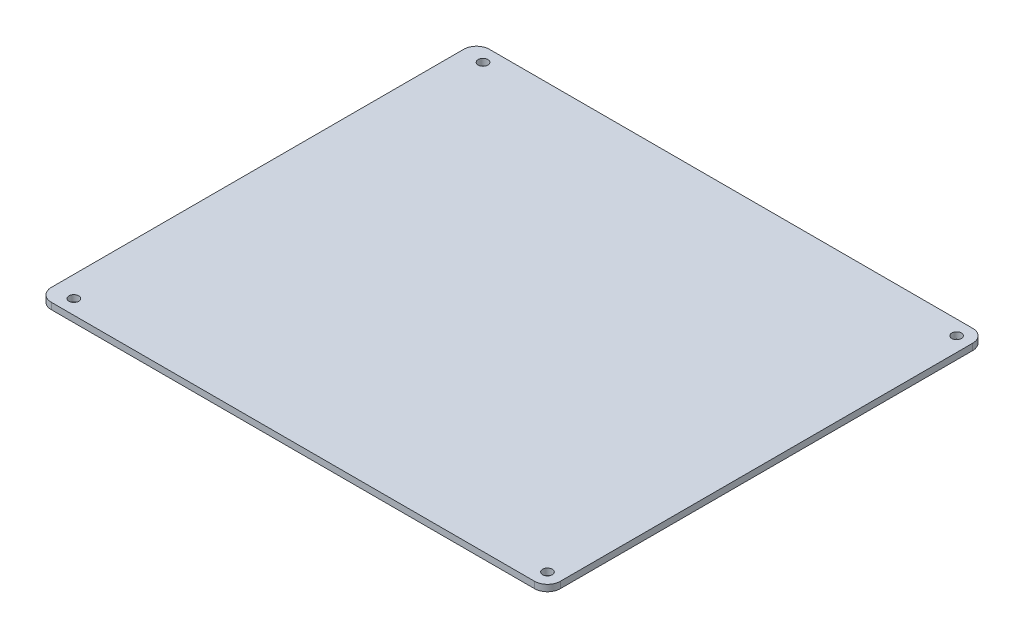
from build123d import *

# Parameters (mm, degrees)
SKETCH8_W           = 158
SKETCH8_H           = 136
SKETCH8_R           = 1.5
BOSS_EXTRUDE4_DEPTH = 2
FILLET2_R           = 4
CUT_EXTRUDE1_DEPTH  = 0.5
CUT_EXTRUDE2_DEPTH  = 0.5
SKETCH13_W          = 6.35
SKETCH13_H          = 1.383974359
CUT_EXTRUDE3_DEPTH  = 0.5
SKETCH14_R          = 0.750267771
SKETCH14_R_2        = 0.265378854
SKETCH14_R_3        = 0.744648083
SKETCH14_R_4        = 0.32969998
SKETCH14_R_5        = 0.283853506
SKETCH14_R_6        = 0.632780779
SKETCH14_W          = 2.64350155
SKETCH14_H          = 3.390658062
CUT_EXTRUDE5_DEPTH  = 0.5
SKETCH15_R          = 1.209251999
CUT_EXTRUDE6_DEPTH  = 0.5


with BuildPart() as part:
    # Sketch8 → Boss-Extrude4 (new body)
    with BuildSketch(Plane(origin=(0, 0, 0), x_dir=(1, 0, 0), z_dir=(0, 1, 0))):
        Rectangle(SKETCH8_W, SKETCH8_H)
        with Locations(Location((74.5, 63.5, 0), (0, 0, 270))):
            Circle(SKETCH8_R, mode=Mode.SUBTRACT)
        with Locations(Location((-72.5, 63.5, 0), (0, 0, 270))):
            Circle(SKETCH8_R, mode=Mode.SUBTRACT)
        with Locations(Location((-72.5, -63.5, 0), (0, 0, 90))):
            Circle(SKETCH8_R, mode=Mode.SUBTRACT)
        with Locations(Location((74.5, -63.5, 0), (0, 0, 90))):
            Circle(SKETCH8_R, mode=Mode.SUBTRACT)
    extrude(amount=BOSS_EXTRUDE4_DEPTH)

    # Fillet2
    fillet2_edges = [part.edges().sort_by_distance(p)[0] for p in [
        (79, 1, 68),
        (-79, 1, 68),
        (-79, 1, -68),
        (79, 1, -68),
    ]]
    fillet(fillet2_edges, radius=FILLET2_R)

    # Sketch10 → Cut-Extrude1 (cut)
    with BuildSketch(Plane.XZ):
        with BuildLine():
            Line((-63.5, 55), (63.5, 55))
            ThreePointArc((63.5, 55), (66.328427125, 53.828427125), (67.5, 51))
            Line((67.5, 51), (67.5, -51))
            ThreePointArc((67.5, -51), (66.328427125, -53.828427125), (63.5, -55))
            Line((63.5, -55), (-63.5, -55))
            ThreePointArc((-63.5, -55), (-66.328427125, -53.828427125), (-67.5, -51))
            Line((-67.5, -51), (-67.5, 51))
            ThreePointArc((-67.5, 51), (-66.328427125, 53.828427125), (-63.5, 55))
        make_face()
        with BuildLine():
            Line((-65.5, 51), (-65.5, -51))
            ThreePointArc((-65.5, -51), (-64.914213562, -52.414213562), (-63.5, -53))
            Line((-63.5, -53), (63.5, -53))
            ThreePointArc((63.5, -53), (64.914213562, -52.414213562), (65.5, -51))
            Line((65.5, -51), (65.5, 51))
            ThreePointArc((65.5, 51), (64.914213562, 52.414213562), (63.5, 53))
            Line((63.5, 53), (-63.5, 53))
            ThreePointArc((-63.5, 53), (-64.914213562, 52.414213562), (-65.5, 51))
        make_face(mode=Mode.SUBTRACT)
    extrude(amount=-CUT_EXTRUDE1_DEPTH, mode=Mode.SUBTRACT)

    # Sketch11 → Cut-Extrude2 (cut)
    with BuildSketch(Plane.XZ):
        with BuildLine():
            Line((-55.5, 48), (-8.613772343, 48))
            ThreePointArc((-8.613772343, 48), (-5.785345218, 46.828427125), (-4.613772343, 44))
            Line((-4.613772343, 44), (-4.613772343, -44))
            ThreePointArc((-4.613772343, -44), (-5.785345218, -46.828427125), (-8.613772343, -48))
            Line((-8.613772343, -48), (-55.5, -48))
            ThreePointArc((-55.5, -48), (-58.328427125, -46.828427125), (-59.5, -44))
            Line((-59.5, -44), (-59.5, 44))
            ThreePointArc((-59.5, 44), (-58.328427125, 46.828427125), (-55.5, 48))
        make_face()
        with BuildLine():
            Line((-57.6, 44), (-57.6, -44))
            ThreePointArc((-57.6, -44), (-56.98492424, -45.48492424), (-55.5, -46.1))
            Line((-55.5, -46.1), (-8.613772343, -46.1))
            ThreePointArc((-8.613772343, -46.1), (-7.128848102, -45.48492424), (-6.513772343, -44))
            Line((-6.513772343, -44), (-6.513772343, 44))
            ThreePointArc((-6.513772343, 44), (-7.128848102, 45.48492424), (-8.613772343, 46.1))
            Line((-8.613772343, 46.1), (-55.5, 46.1))
            ThreePointArc((-55.5, 46.1), (-56.98492424, 45.48492424), (-57.6, 44))
        make_face(mode=Mode.SUBTRACT)
    extrude(amount=-CUT_EXTRUDE2_DEPTH, mode=Mode.SUBTRACT)

    # Sketch13 → Cut-Extrude3 (cut)
    # profile 1 of 21: a face of its own
    with BuildSketch(Plane.XZ):
        Polygon((-40.863772343, 36.024038462), (-40.863772343, 37.367307692), (-36.685136525, 40.583012821), (-40.863772343, 40.583012821), (-40.863772343, 41.966987179), (-34.513772343, 41.966987179), (-34.513772343, 40.612269631), (-38.679687807, 37.408012821), (-34.513772343, 37.408012821), (-34.513772343, 36.024038462), align=None)
    # profile 2 of 21: a face of its own
    with BuildSketch(Plane.XZ):
        Polygon((-40.863772343, 30.550470753), (-40.863772343, 31.970062099), (-34.513772343, 34.843589744), (-34.513772343, 33.36421274), (-35.816336445, 32.786708734), (-35.816336445, 29.737640224), (-34.513772343, 29.160136218), (-34.513772343, 27.679487179), align=None)
        Polygon((-39.160517134, 31.261538462), (-36.956080035, 30.241366186), (-36.956080035, 32.281710737), align=None, mode=Mode.SUBTRACT)
    # profile 3 of 21: a face of its own
    with BuildSketch(Plane.XZ):
        Polygon((-40.863772343, 18.317307692), (-40.863772343, 19.740715144), (-36.809795981, 20.841025641), (-40.863772343, 22.195743189), (-40.863772343, 23.399088542), (-36.809795981, 24.748717949), (-40.863772343, 25.846484375), (-40.863772343, 27.272435897), (-34.513772343, 25.551372196), (-34.513772343, 24.162309696), (-38.618630115, 22.794871795), (-34.513772343, 21.423617788), (-34.513772343, 20.0421875), align=None)
    # profile 4 of 21: a face of its own
    with BuildSketch(Plane.XZ):
        Polygon((-40.863772343, 13.454316907), (-40.863772343, 14.873908253), (-34.513772343, 17.747435897), (-34.513772343, 16.268058894), (-35.816336445, 15.690554888), (-35.816336445, 12.641486378), (-34.513772343, 12.063982372), (-34.513772343, 10.583333333), align=None)
        Polygon((-39.160517134, 14.165384615), (-36.956080035, 13.14521234), (-36.956080035, 15.185556891), align=None, mode=Mode.SUBTRACT)
    # profile 5 of 21: a face of its own
    with BuildSketch(Plane.XZ):
        Polygon((-40.863772343, 2.372345753), (-40.863772343, 3.795753205), (-36.43454558, 5.535897436), (-40.863772343, 7.279857772), (-40.863772343, 8.694360978), (-34.513772343, 9.891346154), (-34.513772343, 8.489563301), (-38.524499506, 7.733974359), (-34.513772343, 6.152834535), (-34.513772343, 4.91260016), (-38.524499506, 3.337820513), (-34.513772343, 2.584775641), (-34.513772343, 1.180448718), align=None)
    # profile 6 of 21: a face of its own
    with BuildSketch(Plane.XZ):
        with BuildLine():
            Line((-40.863772343, -4.192628205), (-40.863772343, -2.671274038))
            add(Edge.make_bspline(
                [(-40.863772343, -2.671274038), (-40.863463949, -2.570773745), (-40.862870449, -2.377361972), (-40.853358626, -2.098320368), (-40.840390508, -1.841613838), (-40.819717429, -1.607508276), (-40.795368963, -1.395982248), (-40.763217723, -1.207217685), (-40.727737246, -1.040251416), (-40.683396282, -0.893415787), (-40.633173887, -0.761201146), (-40.575022733, -0.63833205), (-40.511217801, -0.520810892), (-40.436206645, -0.412235155), (-40.357716821, -0.307534982), (-40.269344794, -0.211169136), (-40.173802085, -0.12048629), (-40.070778161, -0.036928425), (-39.962419, 0.039886164), (-39.846944317, 0.104087542), (-39.728095649, 0.161192378), (-39.603745026, 0.206843807), (-39.47406269, 0.240820403), (-39.340685495, 0.266425943), (-39.202022267, 0.282170317), (-39.107981225, 0.284001905), (-39.060026349, 0.284935897)],
                knots=[0, 0, 0, 0, 1.836140719, 3.533633771, 5.10087734, 6.53173273, 7.827060477, 8.989882129, 10.029329562, 10.943526483, 11.789528399, 12.610909349, 13.425834763, 14.229450232, 15.019697848, 15.81494229, 16.615039843, 17.424496889, 18.236877441, 19.038286661, 19.835340363, 20.644166918, 21.454105773, 22.282181885, 23.124023373, 24, 24, 24, 24], degree=3))
            add(Edge.make_bspline(
                [(-39.060026349, 0.284935897), (-39.009945766, 0.284090021), (-38.911618045, 0.282429236), (-38.767344698, 0.265472128), (-38.628993775, 0.237558168), (-38.49711043, 0.198141717), (-38.371216227, 0.148528159), (-38.252182758, 0.086729315), (-38.139138514, 0.014602467), (-38.032664003, -0.069338377), (-37.931809995, -0.163063155), (-37.83890069, -0.270098031), (-37.750948816, -0.387168277), (-37.669231983, -0.515806687), (-37.596359904, -0.656638526), (-37.526776162, -0.807276811), (-37.464892326, -0.969802505), (-37.429524216, -1.083150851), (-37.411468657, -1.141015625)],
                knots=[0, 0, 0, 0, 1.016036467, 1.994875957, 2.943360592, 3.877249563, 4.784919431, 5.685545373, 6.595049126, 7.502270147, 8.433777149, 9.38499057, 10.374627171, 11.403591613, 12.473727256, 13.590459233, 14.769920025, 16, 16, 16, 16], degree=3))
            Line((-37.411468657, -1.141015625), (-34.513772343, 0.651282051))
            Line((-34.513772343, 0.651282051), (-34.513772343, -0.909505208))
            Line((-34.513772343, -0.909505208), (-37.281721061, -2.621664663))
            Line((-37.281721061, -2.621664663), (-37.281721061, -2.808653846))
            Line((-37.281721061, -2.808653846), (-34.513772343, -2.808653846))
            Line((-34.513772343, -2.808653846), (-34.513772343, -4.192628205))
            Line((-34.513772343, -4.192628205), (-40.863772343, -4.192628205))
        make_face()
        with BuildLine():
            Line((-38.42146465, -2.808653846), (-38.42146465, -2.343088942))
            add(Edge.make_bspline(
                [(-38.42146465, -2.343088942), (-38.422075091, -2.286269231), (-38.423246263, -2.177256851), (-38.428715242, -2.020181447), (-38.441690535, -1.877218578), (-38.458396256, -1.747855822), (-38.477087139, -1.632195612), (-38.504769125, -1.530986178), (-38.534135134, -1.442687552), (-38.570112058, -1.367480881), (-38.6118507, -1.303554766), (-38.658790284, -1.248145377), (-38.713317559, -1.202113783), (-38.772979972, -1.162908745), (-38.840875274, -1.135811461), (-38.9129925, -1.113652171), (-38.992152344, -1.100709267), (-39.046835051, -1.099610327), (-39.075290772, -1.099038462)],
                knots=[0, 0, 0, 0, 1.708363675, 3.277608857, 4.723712974, 6.021838054, 7.199660436, 8.241690857, 9.172961181, 9.993967569, 10.739999558, 11.46313589, 12.168296226, 12.87908003, 13.598837728, 14.357076655, 15.145057537, 16, 16, 16, 16], degree=3))
            add(Edge.make_bspline(
                [(-39.075290772, -1.099038462), (-39.108998893, -1.100141009), (-39.17491013, -1.102296878), (-39.269569741, -1.130163652), (-39.358991926, -1.170007436), (-39.438450687, -1.230007455), (-39.510565985, -1.301483002), (-39.571507926, -1.385948877), (-39.621194137, -1.481690295), (-39.654902612, -1.569824329), (-39.674580548, -1.651130443), (-39.688343804, -1.724120756), (-39.699785421, -1.809035056), (-39.707917495, -1.905017451), (-39.716032179, -2.01268098), (-39.720803061, -2.131891877), (-39.723024397, -2.262941872), (-39.723684769, -2.35411244), (-39.724028753, -2.401602564)],
                knots=[0, 0, 0, 0, 0.985108331, 1.926233394, 2.871946939, 3.841872085, 4.82658799, 5.841305238, 6.881378339, 7.9830261, 8.598222287, 9.332244696, 10.160477909, 11.109455359, 12.156565321, 13.326411148, 14.607345905, 16, 16, 16, 16], degree=3))
            Line((-39.724028753, -2.401602564), (-39.724028753, -2.808653846))
            Line((-39.724028753, -2.808653846), (-38.42146465, -2.808653846))
        make_face(mode=Mode.SUBTRACT)
    # profile 7 of 21: a face of its own
    with BuildSketch(Plane.XZ):
        Polygon((-40.863772343, -9.666195913), (-40.863772343, -8.246604567), (-34.513772343, -5.373076923), (-34.513772343, -6.852453926), (-35.816336445, -7.429957933), (-35.816336445, -10.479026442), (-34.513772343, -11.056530449), (-34.513772343, -12.537179487), align=None)
        Polygon((-39.160517134, -8.955128205), (-36.956080035, -9.975300481), (-36.956080035, -7.934955929), align=None, mode=Mode.SUBTRACT)
    # profile 8 of 21: a face of its own
    with BuildSketch(Plane.XZ):
        with BuildLine():
            Line((-40.863772343, -19.172115385), (-40.863772343, -17.481580529))
            add(Edge.make_bspline(
                [(-40.863772343, -17.481580529), (-40.86300819, -17.349690454), (-40.861530827, -17.09470274), (-40.84423222, -16.725240694), (-40.81894765, -16.381817233), (-40.780044465, -16.065013756), (-40.734821964, -15.773667065), (-40.674826999, -15.509181238), (-40.605736321, -15.270458541), (-40.52465858, -15.055098078), (-40.42984309, -14.858155873), (-40.324433929, -14.671421619), (-40.204227453, -14.494575285), (-40.071668097, -14.325815384), (-39.924899655, -14.166362816), (-39.76373226, -14.016508596), (-39.591144315, -13.873610423), (-39.405203535, -13.741708178), (-39.209575889, -13.620927755), (-39.003462061, -13.516368575), (-38.789717131, -13.427133472), (-38.567313285, -13.354214315), (-38.33659446, -13.298805092), (-38.098275975, -13.257922222), (-37.851698389, -13.233115273), (-37.684589792, -13.230496509), (-37.599729875, -13.229166667)],
                knots=[0, 0, 0, 0, 1.5523959, 3.001301528, 4.352999285, 5.604799306, 6.757683279, 7.822029648, 8.794919534, 9.681123577, 10.527248426, 11.365490068, 12.203018135, 13.041779708, 13.889551746, 14.75116885, 15.630529516, 16.525224616, 17.432610275, 18.334419173, 19.242820097, 20.156703043, 21.086422976, 22.033347148, 23.001308118, 24, 24, 24, 24], degree=3))
            add(Edge.make_bspline(
                [(-37.599729875, -13.229166667), (-37.539081149, -13.230361997), (-37.419350911, -13.23272177), (-37.241302175, -13.244954796), (-37.067449829, -13.268726737), (-36.896413459, -13.298279932), (-36.729666434, -13.339522859), (-36.566245621, -13.389349927), (-36.406329465, -13.447382434), (-36.200199714, -13.537381995), (-35.955668679, -13.667614005), (-35.684872281, -13.852836422), (-35.441251127, -14.067070688), (-35.226528541, -14.307020469), (-35.039880488, -14.56508809), (-34.882348185, -14.835402935), (-34.756796448, -15.116837412), (-34.677768368, -15.363904848), (-34.62833426, -15.578759511), (-34.599358576, -15.767683193), (-34.572851408, -15.982758944), (-34.549623598, -16.224893659), (-34.53397548, -16.494336183), (-34.523065669, -16.790796392), (-34.514974531, -17.114343028), (-34.514183977, -17.339107065), (-34.513772343, -17.456139824)],
                knots=[0, 0, 0, 0, 0.72867537, 1.438521159, 2.142347153, 2.835755973, 3.522642296, 4.204220005, 4.887451593, 5.564982256, 6.904909641, 8.208980868, 9.49747035, 10.792307207, 12.06895256, 13.317393139, 14.544146306, 15.763570442, 16.427113542, 17.190819835, 18.058265318, 19.030390145, 20.11227009, 21.299973169, 22.594118552, 24, 24, 24, 24], degree=3))
            Line((-34.513772343, -17.456139824), (-34.513772343, -19.172115385))
            Line((-34.513772343, -19.172115385), (-40.863772343, -19.172115385))
        make_face()
        with BuildLine():
            Line((-39.724028753, -17.788141026), (-35.653515932, -17.788141026))
            Line((-35.653515932, -17.788141026), (-35.653515932, -17.106330128))
            add(Edge.make_bspline(
                [(-35.653515932, -17.106330128), (-35.65387117, -17.025334708), (-35.654557703, -16.868802439), (-35.663531309, -16.642690879), (-35.678238594, -16.433888519), (-35.70017923, -16.2426029), (-35.725929949, -16.068343385), (-35.758977404, -15.911158795), (-35.797528978, -15.770972635), (-35.844289197, -15.646596577), (-35.897361026, -15.53337001), (-35.958785898, -15.427781175), (-36.028014301, -15.326563144), (-36.104666457, -15.230159854), (-36.191506123, -15.140885457), (-36.284169584, -15.054981044), (-36.386462781, -14.974904042), (-36.496408527, -14.900334115), (-36.613728831, -14.832222423), (-36.738328941, -14.774373392), (-36.869069215, -14.724063656), (-37.006553684, -14.683694794), (-37.150648274, -14.65201576), (-37.301423516, -14.628727051), (-37.458762019, -14.616702009), (-37.565791772, -14.614339437), (-37.620082439, -14.613141026)],
                knots=[0, 0, 0, 0, 1.593054988, 3.078748262, 4.45018865, 5.709219076, 6.86516435, 7.91367016, 8.866821376, 9.721920118, 10.52404956, 11.323703758, 12.121790688, 12.934559088, 13.742692869, 14.569082968, 15.418345626, 16.295053143, 17.180562888, 18.083458198, 18.994215758, 19.933658199, 20.898883592, 21.894404865, 22.931940332, 24, 24, 24, 24], degree=3))
            add(Edge.make_bspline(
                [(-37.620082439, -14.613141026), (-37.703319156, -14.614737356), (-37.865827241, -14.617853968), (-38.1020998, -14.652559542), (-38.324661866, -14.704683893), (-38.532674516, -14.780869484), (-38.727031445, -14.876675145), (-38.904801886, -14.997566996), (-39.071726709, -15.135408383), (-39.16703243, -15.244757928), (-39.21521465, -15.300040064)],
                knots=[0, 0, 0, 0, 1.110513663, 2.168123082, 3.181457114, 4.157496417, 5.119562644, 6.066350345, 7.022435032, 8, 8, 8, 8], degree=3))
            add(Edge.make_bspline(
                [(-39.21521465, -15.300040064), (-39.256591229, -15.354587153), (-39.341489172, -15.466508821), (-39.443267563, -15.65940629), (-39.531230371, -15.873587312), (-39.601619823, -16.112069328), (-39.65743903, -16.373142075), (-39.695640305, -16.658083502), (-39.720421618, -16.965965276), (-39.722799069, -17.179208128), (-39.724028753, -17.289503205)],
                knots=[0, 0, 0, 0, 0.784449229, 1.609560964, 2.493172684, 3.438229973, 4.458316484, 5.553695379, 6.734703866, 8, 8, 8, 8], degree=3))
            Line((-39.724028753, -17.289503205), (-39.724028753, -17.788141026))
        make_face(mode=Mode.SUBTRACT)
    # profile 9 of 21: a face of its own
    with BuildSketch(Plane.XZ):
        with Locations((-37.688772343, -24.50448718)):
            Rectangle(SKETCH13_W, SKETCH13_H)
    # profile 10 of 21: a face of its own
    with BuildSketch(Plane.XZ):
        Polygon((-40.863772343, -31.465064103), (-40.863772343, -30.081089744), (-38.722937006, -30.081089744), (-40.863772343, -28.072546074), (-40.863772343, -26.308233173), (-38.055118497, -28.942618189), (-34.513772343, -26.051282051), (-34.513772343, -27.731640625), (-37.392388128, -30.081089744), (-34.513772343, -30.081089744), (-34.513772343, -31.465064103), align=None)
    # profile 11 of 21: a face of its own
    with BuildSketch(Plane.XZ):
        with Locations((-37.688772343, -33.866666667)):
            Rectangle(SKETCH13_W, SKETCH13_H)
    # profile 12 of 21: a face of its own
    with BuildSketch(Plane.XZ):
        with BuildLine():
            Line((-40.863772343, -41.641346154), (-40.863772343, -39.950811298))
            add(Edge.make_bspline(
                [(-40.863772343, -39.950811298), (-40.86300819, -39.818921224), (-40.861530827, -39.563933509), (-40.84423222, -39.194471464), (-40.81894765, -38.851048002), (-40.780044465, -38.534244525), (-40.734821964, -38.242897834), (-40.674826999, -37.978412008), (-40.605736321, -37.739689311), (-40.52465858, -37.524328848), (-40.42984309, -37.327386642), (-40.324433929, -37.140652388), (-40.204227453, -36.963806054), (-40.071668097, -36.795046154), (-39.924899655, -36.635593585), (-39.76373226, -36.485739365), (-39.591144315, -36.342841192), (-39.405203535, -36.210938947), (-39.209575889, -36.090158525), (-39.003462061, -35.985599344), (-38.789717131, -35.896364242), (-38.567313285, -35.823445084), (-38.33659446, -35.768035862), (-38.098275975, -35.727152991), (-37.851698389, -35.702346043), (-37.684589792, -35.699727278), (-37.599729875, -35.698397436)],
                knots=[0, 0, 0, 0, 1.5523959, 3.001301528, 4.352999285, 5.604799306, 6.757683279, 7.822029648, 8.794919534, 9.681123577, 10.527248426, 11.365490068, 12.203018135, 13.041779708, 13.889551746, 14.75116885, 15.630529516, 16.525224616, 17.432610275, 18.334419173, 19.242820097, 20.156703043, 21.086422976, 22.033347148, 23.001308118, 24, 24, 24, 24], degree=3))
            add(Edge.make_bspline(
                [(-37.599729875, -35.698397436), (-37.539081149, -35.699592766), (-37.419350911, -35.701952539), (-37.241302175, -35.714185566), (-37.067449829, -35.737957506), (-36.896413459, -35.767510701), (-36.729666434, -35.808753629), (-36.566245621, -35.858580696), (-36.406329465, -35.916613204), (-36.200199714, -36.006612765), (-35.955668679, -36.136844774), (-35.684872281, -36.322067191), (-35.441251127, -36.536301457), (-35.226528541, -36.776251239), (-35.039880488, -37.034318859), (-34.882348185, -37.304633704), (-34.756796448, -37.586068181), (-34.677768368, -37.833135617), (-34.62833426, -38.04799028), (-34.599358576, -38.236913962), (-34.572851408, -38.451989713), (-34.549623598, -38.694124428), (-34.53397548, -38.963566953), (-34.523065669, -39.260027161), (-34.514974531, -39.583573797), (-34.514183977, -39.808337834), (-34.513772343, -39.925370593)],
                knots=[0, 0, 0, 0, 0.72867537, 1.438521159, 2.142347153, 2.835755973, 3.522642296, 4.204220005, 4.887451593, 5.564982256, 6.904909641, 8.208980868, 9.49747035, 10.792307207, 12.06895256, 13.317393139, 14.544146306, 15.763570442, 16.427113542, 17.190819835, 18.058265318, 19.030390145, 20.11227009, 21.299973169, 22.594118552, 24, 24, 24, 24], degree=3))
            Line((-34.513772343, -39.925370593), (-34.513772343, -41.641346154))
            Line((-34.513772343, -41.641346154), (-40.863772343, -41.641346154))
        make_face()
        with BuildLine():
            Line((-39.724028753, -40.257371795), (-35.653515932, -40.257371795))
            Line((-35.653515932, -40.257371795), (-35.653515932, -39.575560897))
            add(Edge.make_bspline(
                [(-35.653515932, -39.575560897), (-35.65387117, -39.494565477), (-35.654557703, -39.338033209), (-35.663531309, -39.111921649), (-35.678238594, -38.903119288), (-35.70017923, -38.711833669), (-35.725929949, -38.537574155), (-35.758977404, -38.380389565), (-35.797528978, -38.240203404), (-35.844289197, -38.115827346), (-35.897361026, -38.002600779), (-35.958785898, -37.897011944), (-36.028014301, -37.795793914), (-36.104666457, -37.699390623), (-36.191506123, -37.610116226), (-36.284169584, -37.524211813), (-36.386462781, -37.444134811), (-36.496408527, -37.369564884), (-36.613728831, -37.301453192), (-36.738328941, -37.243604161), (-36.869069215, -37.193294425), (-37.006553684, -37.152925563), (-37.150648274, -37.12124653), (-37.301423516, -37.097957821), (-37.458762019, -37.085932778), (-37.565791772, -37.083570206), (-37.620082439, -37.082371795)],
                knots=[0, 0, 0, 0, 1.593054988, 3.078748262, 4.45018865, 5.709219076, 6.86516435, 7.91367016, 8.866821376, 9.721920118, 10.52404956, 11.323703758, 12.121790688, 12.934559088, 13.742692869, 14.569082968, 15.418345626, 16.295053143, 17.180562888, 18.083458198, 18.994215758, 19.933658199, 20.898883592, 21.894404865, 22.931940332, 24, 24, 24, 24], degree=3))
            add(Edge.make_bspline(
                [(-37.620082439, -37.082371795), (-37.703319156, -37.083968125), (-37.865827241, -37.087084738), (-38.1020998, -37.121790312), (-38.324661866, -37.173914662), (-38.532674516, -37.250100253), (-38.727031445, -37.345905914), (-38.904801886, -37.466797766), (-39.071726709, -37.604639152), (-39.16703243, -37.713988697), (-39.21521465, -37.769270833)],
                knots=[0, 0, 0, 0, 1.110513663, 2.168123082, 3.181457114, 4.157496417, 5.119562644, 6.066350345, 7.022435032, 8, 8, 8, 8], degree=3))
            add(Edge.make_bspline(
                [(-39.21521465, -37.769270833), (-39.256591229, -37.823817923), (-39.341489172, -37.93573959), (-39.443267563, -38.12863706), (-39.531230371, -38.342818081), (-39.601619823, -38.581300097), (-39.65743903, -38.842372844), (-39.695640305, -39.127314271), (-39.720421618, -39.435196046), (-39.722799069, -39.648438898), (-39.724028753, -39.758733974)],
                knots=[0, 0, 0, 0, 0.784449229, 1.609560964, 2.493172684, 3.438229973, 4.458316484, 5.553695379, 6.734703866, 8, 8, 8, 8], degree=3))
            Line((-39.724028753, -39.758733974), (-39.724028753, -40.257371795))
        make_face(mode=Mode.SUBTRACT)
    # profile 13 of 21: a face of its own
    with BuildSketch(Plane.XZ):
        Polygon((-29.03620824, 23.925711138), (-29.03620824, 25.4), (-24.884285163, 25.4), (-24.884285163, 26.051282051), (-23.82595183, 26.051282051), (-23.82595183, 25.4), (-22.523387727, 25.4), (-22.523387727, 24.016025641), (-23.82595183, 24.016025641), (-23.82595183, 20.759615385), (-25.024209041, 20.759615385), align=None)
        Polygon((-24.884285163, 24.016025641), (-27.045473064, 24.016025641), (-24.884285163, 22.311498397), align=None, mode=Mode.SUBTRACT)
    # profile 14 of 21: a face of its own
    with BuildSketch(Plane.XZ):
        with BuildLine():
            Line((-29.03620824, 17.667297676), (-28.51340175, 18.906260016))
            Line((-28.51340175, 18.906260016), (-26.349669779, 17.578255208))
            add(Edge.make_bspline(
                [(-26.349669779, 17.578255208), (-26.348016589, 17.656350947), (-26.344772021, 17.809622445), (-26.317466902, 18.035266909), (-26.272081645, 18.251584715), (-26.207396741, 18.458876478), (-26.128249027, 18.65820593), (-26.027617426, 18.847806359), (-25.909314074, 19.028079165), (-25.774921765, 19.198047605), (-25.627580667, 19.353499651), (-25.469749533, 19.490247502), (-25.302800986, 19.606266318), (-25.126973808, 19.700612906), (-24.941688737, 19.774023771), (-24.74784858, 19.825513657), (-24.545378109, 19.858896037), (-24.40740552, 19.862348551), (-24.337310003, 19.864102564)],
                knots=[0, 0, 0, 0, 1.104852299, 2.168394447, 3.211064878, 4.228357633, 5.237852068, 6.241677703, 7.260190732, 8.285380527, 9.303981925, 10.28673003, 11.235459418, 12.175036862, 13.104307491, 14.048948534, 15.008788892, 16, 16, 16, 16], degree=3))
            add(Edge.make_bspline(
                [(-24.337310003, 19.864102564), (-24.269744353, 19.862414181), (-24.135895495, 19.85906946), (-23.939746015, 19.824321682), (-23.750929239, 19.771178513), (-23.570555415, 19.695748268), (-23.398716971, 19.597469488), (-23.234075495, 19.47904798), (-23.078367745, 19.337532489), (-22.932246071, 19.17709939), (-22.799065924, 19.001879033), (-22.680264129, 18.816807545), (-22.583017296, 18.620773684), (-22.500664565, 18.417458313), (-22.438721546, 18.204145029), (-22.392610202, 17.983130362), (-22.365513975, 17.752350902), (-22.362236571, 17.595710705), (-22.360567215, 17.515925481)],
                knots=[0, 0, 0, 0, 0.950200861, 1.882366258, 2.79485287, 3.707124736, 4.62659236, 5.575761667, 6.556204861, 7.58281384, 8.626150887, 9.651092898, 10.673407406, 11.70194045, 12.734983526, 13.795507081, 14.877133927, 16, 16, 16, 16], degree=3))
            add(Edge.make_bspline(
                [(-22.360567215, 17.515925481), (-22.361963128, 17.432721301), (-22.364700039, 17.269586311), (-22.395487435, 17.030572215), (-22.442187189, 16.8020746), (-22.506665914, 16.583122914), (-22.592168751, 16.375227358), (-22.697483819, 16.178560277), (-22.819514556, 15.991683622), (-22.96056926, 15.81900485), (-23.112481553, 15.661494027), (-23.27228515, 15.523308892), (-23.436741617, 15.404846011), (-23.607907056, 15.308923201), (-23.784730526, 15.234707001), (-23.966679418, 15.180632122), (-24.15464048, 15.14781486), (-24.282059183, 15.144151957), (-24.34621425, 15.142307692)],
                knots=[0, 0, 0, 0, 1.163605067, 2.28143228, 3.365885876, 4.424585855, 5.470171178, 6.505301569, 7.541995037, 8.58811887, 9.620286534, 10.600377861, 11.540431962, 12.451506364, 13.339631748, 14.218193408, 15.102863888, 16, 16, 16, 16], degree=3))
            add(Edge.make_bspline(
                [(-24.34621425, 15.142307692), (-24.395873449, 15.143581582), (-24.495552643, 15.146138617), (-24.645146712, 15.165442356), (-24.79431748, 15.199931438), (-24.921102249, 15.23587979), (-25.026900826, 15.277018297), (-25.117466735, 15.315139227), (-25.217667964, 15.362132664), (-25.327186396, 15.419166905), (-25.448134382, 15.482216966), (-25.578846654, 15.554605593), (-25.718879731, 15.636893444), (-25.815842121, 15.693942433), (-25.866296381, 15.723627804)],
                knots=[0, 0, 0, 0, 1.083710445, 2.175294508, 3.284428465, 4.423427011, 5.047302797, 5.760584302, 6.567863041, 7.461823998, 8.455286899, 9.544672085, 10.722373158, 12, 12, 12, 12], degree=3))
            Line((-25.866296381, 15.723627804), (-29.03620824, 17.667297676))
        make_face()
        with BuildLine():
            add(Edge.make_bspline(
                [(-25.291336445, 17.485396635), (-25.288904643, 17.419743493), (-25.284189046, 17.292433059), (-25.233040509, 17.110584269), (-25.153762845, 16.944761611), (-25.061010919, 16.822348733), (-24.973873752, 16.737475084), (-24.904820278, 16.680066064), (-24.830279538, 16.633523955), (-24.753012898, 16.593092946), (-24.67045952, 16.564345637), (-24.58452203, 16.54263861), (-24.494704277, 16.527788502), (-24.433195805, 16.526787), (-24.402183801, 16.526282051)],
                knots=[0, 0, 0, 0, 1.615041626, 3.13178689, 4.618834842, 6.126543818, 6.888081144, 7.616378775, 8.335689859, 9.051115013, 9.762171936, 10.484894433, 11.236097757, 12, 12, 12, 12], degree=3))
            add(Edge.make_bspline(
                [(-24.402183801, 16.526282051), (-24.370769687, 16.527434877), (-24.309381583, 16.529687678), (-24.218809692, 16.542280755), (-24.132618222, 16.565139624), (-24.050127907, 16.59769439), (-23.971206317, 16.637875339), (-23.896845735, 16.688770932), (-23.825387588, 16.746738935), (-23.738095482, 16.837118332), (-23.642937015, 16.961064584), (-23.560038427, 17.126699254), (-23.509556164, 17.304801902), (-23.503430654, 17.427826036), (-23.500310804, 17.490484776)],
                knots=[0, 0, 0, 0, 0.771750927, 1.508122302, 2.240654537, 2.956186265, 3.682772524, 4.410626367, 5.165326201, 5.938551208, 7.492312259, 8.982623137, 10.463187472, 12, 12, 12, 12], degree=3))
            add(Edge.make_bspline(
                [(-23.500310804, 17.490484776), (-23.503558277, 17.556057626), (-23.509909526, 17.684301806), (-23.557799835, 17.8695474), (-23.639867786, 18.039124116), (-23.733212493, 18.1659565), (-23.820376935, 18.256426264), (-23.890200994, 18.317457557), (-23.966225671, 18.366025774), (-24.044162548, 18.410094407), (-24.12826744, 18.440523907), (-24.215732234, 18.464578917), (-24.307727312, 18.476566082), (-24.370357118, 18.478927964), (-24.402183801, 18.480128205)],
                knots=[0, 0, 0, 0, 1.581677803, 3.09336824, 4.58103324, 6.103975483, 6.871201912, 7.611611879, 8.335426315, 9.045213142, 9.767506578, 10.487403377, 11.231341477, 12, 12, 12, 12], degree=3))
            add(Edge.make_bspline(
                [(-24.402183801, 18.480128205), (-24.433203403, 18.479643352), (-24.494726945, 18.478681707), (-24.584434516, 18.463540188), (-24.671061973, 18.442821348), (-24.752410663, 18.410032692), (-24.830670072, 18.370652677), (-24.905255325, 18.322459562), (-24.973440293, 18.262452492), (-25.061872705, 18.175735245), (-25.15365934, 18.048518928), (-25.233895038, 17.876847044), (-25.284022348, 17.687060824), (-25.288849036, 17.553979442), (-25.291336445, 17.485396635)],
                knots=[0, 0, 0, 0, 0.748385906, 1.484330833, 2.192373433, 2.896180001, 3.597073481, 4.307335424, 5.033954227, 5.787231139, 7.297193698, 8.791018416, 10.34626781, 12, 12, 12, 12], degree=3))
        make_face(mode=Mode.SUBTRACT)
    # profile 15 of 21: a face of its own
    with BuildSketch(Plane.XZ):
        with BuildLine():
            add(Edge.make_bspline(
                [(-29.03620824, 11.700180288), (-29.03538598, 11.766788056), (-29.033770215, 11.897674187), (-29.01642236, 12.090469205), (-28.989857053, 12.276478347), (-28.953796209, 12.455688675), (-28.904698938, 12.627126373), (-28.846174968, 12.791602538), (-28.777824876, 12.949755576), (-28.697494024, 13.100424488), (-28.605322986, 13.242800742), (-28.503988254, 13.37896937), (-28.388271232, 13.504218674), (-28.264267768, 13.623625175), (-28.126226487, 13.731515023), (-27.979306958, 13.833401399), (-27.820485472, 13.926895124), (-27.649094299, 14.010903225), (-27.463670757, 14.086676344), (-27.261388328, 14.150834152), (-27.04289238, 14.207255963), (-26.80635638, 14.250474144), (-26.553152195, 14.286922096), (-26.282143936, 14.309472873), (-25.994543915, 14.325638164), (-25.797207725, 14.327334028), (-25.695843657, 14.328205128)],
                knots=[0, 0, 0, 0, 0.986826532, 1.939141818, 2.865971136, 3.770486801, 4.645674334, 5.506235902, 6.356063545, 7.196571521, 8.033195155, 8.867645124, 9.708340974, 10.557262185, 11.415917643, 12.301331143, 13.205475706, 14.144051843, 15.127692503, 16.170920553, 17.286481654, 18.46954603, 19.732275457, 21.075970943, 22.498037898, 24, 24, 24, 24], degree=3))
            add(Edge.make_bspline(
                [(-25.695843657, 14.328205128), (-25.59321309, 14.32728527), (-25.393768655, 14.325497689), (-25.103510783, 14.310080914), (-24.830606533, 14.284954026), (-24.575376003, 14.249934199), (-24.337548714, 14.204169739), (-24.117341497, 14.14869292), (-23.91437145, 14.082960471), (-23.728427599, 14.006046703), (-23.557661039, 13.91978401), (-23.397815473, 13.829116266), (-23.251350228, 13.728609214), (-23.114372903, 13.624049958), (-22.991121763, 13.509869468), (-22.877946787, 13.390625774), (-22.77918254, 13.262130575), (-22.688631618, 13.1283528), (-22.611796345, 12.985017248), (-22.543000959, 12.834258505), (-22.488600675, 12.673476503), (-22.440040041, 12.504946004), (-22.405925727, 12.326373951), (-22.378396594, 12.139329157), (-22.363472323, 11.942958935), (-22.36154896, 11.809173677), (-22.360567215, 11.740885417)],
                knots=[0, 0, 0, 0, 1.53004645, 2.973375868, 4.332102595, 5.615022274, 6.812669083, 7.941130964, 8.998660699, 9.990675271, 10.937761969, 11.849679441, 12.72811483, 13.584178203, 14.416381081, 15.230376939, 16.032104778, 16.829859994, 17.636086303, 18.453829307, 19.297525861, 20.164144427, 21.066701424, 22.005417442, 22.981901487, 24, 24, 24, 24], degree=3))
            add(Edge.make_bspline(
                [(-22.360567215, 11.740885417), (-22.361556249, 11.672596934), (-22.363500015, 11.538388492), (-22.378423323, 11.341181713), (-22.405841601, 11.152833709), (-22.44050492, 10.972306246), (-22.488236584, 10.800431753), (-22.544618456, 10.635789813), (-22.614109656, 10.480785084), (-22.691535241, 10.332995481), (-22.78112547, 10.19428765), (-22.880645675, 10.062936757), (-22.989972245, 9.938751736), (-23.112172775, 9.824028166), (-23.24437243, 9.716119355), (-23.387032692, 9.614810266), (-23.542044786, 9.524110094), (-23.706704906, 9.437637872), (-23.886356182, 9.35997479), (-24.084161864, 9.296957026), (-24.298626672, 9.239758515), (-24.531906957, 9.1969161), (-24.782628722, 9.160899485), (-25.051364977, 9.13613783), (-25.33779292, 9.120633204), (-25.534697915, 9.118860993), (-25.636058, 9.117948718)],
                knots=[0, 0, 0, 0, 1.023221228, 2.010952973, 2.960682302, 3.874011571, 4.763358527, 5.631389659, 6.47904572, 7.306117631, 8.129153172, 8.950027866, 9.773651744, 10.605080346, 11.45845546, 12.329249144, 13.223823138, 14.147371026, 15.115099819, 16.151822583, 17.255203172, 18.438958645, 19.703167639, 21.049754519, 22.481312608, 24, 24, 24, 24], degree=3))
            add(Edge.make_bspline(
                [(-25.636058, 9.117948718), (-25.776879761, 9.119884492), (-26.04866913, 9.123620583), (-26.441628598, 9.152611565), (-26.804467476, 9.201727346), (-27.137811289, 9.269126016), (-27.440865037, 9.358177104), (-27.714506957, 9.465597054), (-27.959467174, 9.592984812), (-28.102838848, 9.697903313), (-28.172496301, 9.748878205)],
                knots=[0, 0, 0, 0, 1.270554087, 2.452199792, 3.552731428, 4.572428878, 5.517880761, 6.398834259, 7.222069991, 8, 8, 8, 8], degree=3))
            add(Edge.make_bspline(
                [(-28.172496301, 9.748878205), (-28.241453099, 9.808781166), (-28.377633885, 9.927081791), (-28.55342529, 10.130538272), (-28.704390967, 10.349047011), (-28.825174263, 10.587054041), (-28.921356366, 10.841019139), (-28.988351823, 11.1126015), (-29.028051638, 11.400922605), (-29.033442644, 11.598713308), (-29.03620824, 11.700180288)],
                knots=[0, 0, 0, 0, 0.990681992, 1.956469204, 2.910354335, 3.867787993, 4.846848932, 5.852890592, 6.898529083, 8, 8, 8, 8], degree=3))
        make_face()
        with BuildLine():
            add(Edge.make_bspline(
                [(-27.89646465, 11.733253205), (-27.893992719, 11.674127449), (-27.889123552, 11.557662609), (-27.851430893, 11.388422865), (-27.789083675, 11.229676302), (-27.718815903, 11.105673787), (-27.6476612, 11.014100521), (-27.585303415, 10.948917903), (-27.512739811, 10.889247049), (-27.433035683, 10.83170434), (-27.343506235, 10.779492443), (-27.244885473, 10.733385918), (-27.13907442, 10.687745968), (-27.022479515, 10.648503768), (-26.89443459, 10.614576472), (-26.753676744, 10.583490756), (-26.59892509, 10.559179236), (-26.430610593, 10.537093749), (-26.24854656, 10.520985733), (-26.052564027, 10.509640527), (-25.84258926, 10.503628154), (-25.697967099, 10.502503456), (-25.623337647, 10.501923077)],
                knots=[0, 0, 0, 0, 1.214587884, 2.392473148, 3.543218464, 4.71073995, 5.306973042, 5.923376398, 6.560563542, 7.235326945, 7.942358987, 8.686911065, 9.471985168, 10.309854188, 11.212615155, 12.193875539, 13.271361611, 14.431311457, 15.682769858, 17.027249578, 18.465969985, 20, 20, 20, 20], degree=3))
            add(Edge.make_bspline(
                [(-25.623337647, 10.501923077), (-25.526635736, 10.502688228), (-25.341132758, 10.504156014), (-25.074577773, 10.521059443), (-24.831278936, 10.547249423), (-24.610853548, 10.582926781), (-24.413991339, 10.631299346), (-24.239697533, 10.688921219), (-24.088500101, 10.758163414), (-23.960222173, 10.839895866), (-23.851453959, 10.929795089), (-23.757619715, 11.025806045), (-23.678159499, 11.128176206), (-23.612387211, 11.236697037), (-23.56292702, 11.352118566), (-23.526784363, 11.473261059), (-23.504795786, 11.601014678), (-23.501823715, 11.688645413), (-23.500310804, 11.733253205)],
                knots=[0, 0, 0, 0, 1.679342007, 3.221476598, 4.636553652, 5.928371343, 7.096505702, 8.153804033, 9.112563178, 9.976743654, 10.787664292, 11.558432598, 12.303803208, 13.03380825, 13.7561581, 14.478470409, 15.225476363, 16, 16, 16, 16], degree=3))
            add(Edge.make_bspline(
                [(-23.500310804, 11.733253205), (-23.501362901, 11.776165697), (-23.503417302, 11.859959821), (-23.524478646, 11.982153768), (-23.558751794, 12.097630226), (-23.607437764, 12.20604927), (-23.669145477, 12.307953698), (-23.745134201, 12.402473524), (-23.834105718, 12.490800239), (-23.902047456, 12.541771926), (-23.936618897, 12.567708333)],
                knots=[0, 0, 0, 0, 1.048278946, 2.046947455, 3.02099404, 3.986174388, 4.94442698, 5.925508864, 6.944416953, 8, 8, 8, 8], degree=3))
            add(Edge.make_bspline(
                [(-23.936618897, 12.567708333), (-23.983493681, 12.598022348), (-24.081215271, 12.661219094), (-24.24681364, 12.738607856), (-24.435265811, 12.800443992), (-24.644522315, 12.854728763), (-24.876635318, 12.893433844), (-25.129876485, 12.924999996), (-25.405640332, 12.940046527), (-25.59661311, 12.942800032), (-25.695843657, 12.944230769)],
                knots=[0, 0, 0, 0, 0.73363436, 1.529434623, 2.395365967, 3.339496309, 4.370063941, 5.48791158, 6.694704504, 8, 8, 8, 8], degree=3))
            add(Edge.make_bspline(
                [(-25.695843657, 12.944230769), (-25.79594116, 12.943497958), (-25.988652568, 12.942087122), (-26.265267952, 12.924656974), (-26.518075969, 12.900648721), (-26.746394418, 12.864286796), (-26.950531036, 12.816326118), (-27.130911131, 12.758461713), (-27.287509716, 12.690352596), (-27.420882994, 12.610990259), (-27.531910121, 12.520906675), (-27.630597683, 12.428567391), (-27.711652209, 12.327056084), (-27.780424237, 12.221132256), (-27.832958492, 12.108074791), (-27.870019696, 11.98873956), (-27.891951728, 11.862958251), (-27.894942088, 11.777012879), (-27.89646465, 11.733253205)],
                knots=[0, 0, 0, 0, 1.705083879, 3.282690406, 4.720299792, 6.030237024, 7.218210755, 8.289614354, 9.253402044, 10.121863153, 10.924008211, 11.685264082, 12.4197249, 13.131122611, 13.832435875, 14.536163306, 15.254677544, 16, 16, 16, 16], degree=3))
        make_face(mode=Mode.SUBTRACT)
    # profile 16 of 21: a face of its own
    with BuildSketch(Plane.XZ):
        Polygon((-28.873387727, 4.665825321), (-28.873387727, 6.838461538), (-22.523387727, 6.838461538), (-22.523387727, 5.454487179), (-27.815054394, 5.454487179), (-27.815054394, 3.826282051), align=None)
    # profile 17 of 21: a face of its own
    with BuildSketch(Plane.XZ):
        with BuildLine():
            Line((-26.756721061, -1.058333333), (-26.756721061, -2.442307692))
            add(Edge.make_bspline(
                [(-26.756721061, -2.442307692), (-26.842975008, -2.435757147), (-27.011717764, -2.422942), (-27.256757435, -2.378686969), (-27.488797176, -2.317682379), (-27.705206988, -2.232200042), (-27.909709068, -2.131566182), (-28.097251759, -2.005994685), (-28.272442164, -1.863824744), (-28.431330753, -1.701595043), (-28.573630895, -1.523845555), (-28.697218127, -1.332272246), (-28.802495324, -1.12881017), (-28.887035974, -0.912771186), (-28.955732514, -0.685476811), (-29.00109694, -0.445352705), (-29.032171003, -0.193740444), (-29.034843205, -0.021724603), (-29.03620824, 0.066145833)],
                knots=[0, 0, 0, 0, 1.094911714, 2.14202856, 3.149020222, 4.128339032, 5.08418636, 6.029979122, 6.980258772, 7.937206708, 8.900013288, 9.859293944, 10.820016542, 11.796297507, 12.793663542, 13.822624809, 14.887736687, 16, 16, 16, 16], degree=3))
            add(Edge.make_bspline(
                [(-29.03620824, 0.066145833), (-29.033620634, 0.174044378), (-29.028582029, 0.384145158), (-28.97948457, 0.688906772), (-28.904436684, 0.975094077), (-28.796030862, 1.240570119), (-28.657941664, 1.483547715), (-28.493426158, 1.702986477), (-28.300212447, 1.896063534), (-28.082774688, 2.059401125), (-27.85151663, 2.192154912), (-27.613911013, 2.289145402), (-27.373697925, 2.349620296), (-27.212017716, 2.357163079), (-27.131971461, 2.360897436)],
                knots=[0, 0, 0, 0, 1.171962649, 2.282053653, 3.34638693, 4.381992327, 5.389263176, 6.376490328, 7.354182589, 8.347865147, 9.324263826, 10.244310975, 11.130775921, 12, 12, 12, 12], degree=3))
            add(Edge.make_bspline(
                [(-27.131971461, 2.360897436), (-27.083595794, 2.359439127), (-26.986156467, 2.356501768), (-26.838461254, 2.339760791), (-26.688545114, 2.310009641), (-26.535603886, 2.269130062), (-26.380165526, 2.216723227), (-26.221981258, 2.152510134), (-26.060872094, 2.077774313), (-25.896299144, 1.990309544), (-25.726356547, 1.88743646), (-25.55067676, 1.765182355), (-25.366966618, 1.624112203), (-25.174718319, 1.465567503), (-24.976763297, 1.285320308), (-24.77118798, 1.086668855), (-24.55650203, 0.870373336), (-24.41442351, 0.716613422), (-24.341126109, 0.637289663)],
                knots=[0, 0, 0, 0, 0.688694447, 1.387183428, 2.11276027, 2.86231426, 3.63909801, 4.446034928, 5.291203246, 6.165979058, 7.097541031, 8.117091126, 9.210744093, 10.393831962, 11.662941326, 13.020297505, 14.462790515, 16, 16, 16, 16], degree=3))
            Line((-24.341126109, 0.637289663), (-23.581721061, -0.183173077))
            Line((-23.581721061, -0.183173077), (-23.581721061, 2.442307692))
            Line((-23.581721061, 2.442307692), (-22.523387727, 2.442307692))
            Line((-22.523387727, 2.442307692), (-22.523387727, -2.686538462))
            Line((-22.523387727, -2.686538462), (-23.100891734, -2.686538462))
            Line((-23.100891734, -2.686538462), (-25.101803192, -0.399419071))
            add(Edge.make_bspline(
                [(-25.101803192, -0.399419071), (-25.160002143, -0.332989912), (-25.272185744, -0.20494186), (-25.439439125, -0.024390008), (-25.59646292, 0.14048753), (-25.746522288, 0.286089263), (-25.886677914, 0.415834465), (-26.018392903, 0.527253017), (-26.140873859, 0.622826676), (-26.289581943, 0.723179583), (-26.464539105, 0.823371203), (-26.668972774, 0.909799718), (-26.863038516, 0.966734575), (-26.990861018, 0.973632648), (-27.05183324, 0.976923077)],
                knots=[0, 0, 0, 0, 1.296847865, 2.499788417, 3.613915099, 4.639853241, 5.56968939, 6.417957702, 7.172675718, 7.849648746, 9.051363979, 10.125684013, 11.10593823, 12, 12, 12, 12], degree=3))
            add(Edge.make_bspline(
                [(-27.05183324, 0.976923077), (-27.081576057, 0.976418568), (-27.140560645, 0.97541805), (-27.226575815, 0.960569111), (-27.308730015, 0.938877507), (-27.387436081, 0.909982184), (-27.461341504, 0.869822393), (-27.531277822, 0.821602782), (-27.596904535, 0.764419077), (-27.679505654, 0.678870518), (-27.767381363, 0.554014216), (-27.843290659, 0.383068894), (-27.888198364, 0.191807957), (-27.893643875, 0.057910552), (-27.89646465, -0.011448317)],
                knots=[0, 0, 0, 0, 0.735439748, 1.458490348, 2.153571291, 2.837868939, 3.528178103, 4.229885023, 4.936910351, 5.679283792, 7.170398876, 8.688063001, 10.284416287, 12, 12, 12, 12], degree=3))
            add(Edge.make_bspline(
                [(-27.89646465, -0.011448317), (-27.895401927, -0.047528614), (-27.893318323, -0.118268553), (-27.879468759, -0.221967488), (-27.854751331, -0.320628619), (-27.821773211, -0.415458203), (-27.778900124, -0.505887157), (-27.724278218, -0.590383292), (-27.661595243, -0.670703164), (-27.591156153, -0.74728148), (-27.510536043, -0.815278575), (-27.423924257, -0.877275941), (-27.329330255, -0.929086183), (-27.228075073, -0.972912574), (-27.119537981, -1.006565054), (-27.00487165, -1.033549601), (-26.883167027, -1.051618587), (-26.799606232, -1.056055973), (-26.756721061, -1.058333333)],
                knots=[0, 0, 0, 0, 1.001765848, 1.964087337, 2.8977549, 3.821123521, 4.747863068, 5.668827078, 6.608413354, 7.574615477, 8.551445322, 9.531320797, 10.527259149, 11.539758509, 12.58968705, 13.677668045, 14.808130021, 16, 16, 16, 16], degree=3))
        make_face()
    # profile 18 of 21: a face of its own
    with BuildSketch(Plane.XZ):
        with BuildLine():
            Line((-26.756721061, -6.919871795), (-26.756721061, -8.303846154))
            add(Edge.make_bspline(
                [(-26.756721061, -8.303846154), (-26.842975008, -8.297295609), (-27.011717764, -8.284480462), (-27.256757435, -8.240225431), (-27.488797176, -8.179220841), (-27.705206988, -8.093738504), (-27.909709068, -7.993104643), (-28.097251759, -7.867533146), (-28.272442164, -7.725363206), (-28.431330753, -7.563133504), (-28.573630895, -7.385384017), (-28.697218127, -7.193810707), (-28.802495324, -6.990348631), (-28.887035974, -6.774309647), (-28.955732514, -6.547015272), (-29.00109694, -6.306891167), (-29.032171003, -6.055278905), (-29.034843205, -5.883263065), (-29.03620824, -5.795392628)],
                knots=[0, 0, 0, 0, 1.094911714, 2.14202856, 3.149020222, 4.128339032, 5.08418636, 6.029979122, 6.980258772, 7.937206708, 8.900013288, 9.859293944, 10.820016542, 11.796297507, 12.793663542, 13.822624809, 14.887736687, 16, 16, 16, 16], degree=3))
            add(Edge.make_bspline(
                [(-29.03620824, -5.795392628), (-29.033620634, -5.687494084), (-29.028582029, -5.477393303), (-28.97948457, -5.17263169), (-28.904436684, -4.886444385), (-28.796030862, -4.620968343), (-28.657941664, -4.377990747), (-28.493426158, -4.158551985), (-28.300212447, -3.965474928), (-28.082774688, -3.802137337), (-27.85151663, -3.669383549), (-27.613911013, -3.572393059), (-27.373697925, -3.511918166), (-27.212017716, -3.504375382), (-27.131971461, -3.500641026)],
                knots=[0, 0, 0, 0, 1.171962649, 2.282053653, 3.34638693, 4.381992327, 5.389263176, 6.376490328, 7.354182589, 8.347865147, 9.324263826, 10.244310975, 11.130775921, 12, 12, 12, 12], degree=3))
            add(Edge.make_bspline(
                [(-27.131971461, -3.500641026), (-27.083595794, -3.502099335), (-26.986156467, -3.505036693), (-26.838461254, -3.521777671), (-26.688545114, -3.551528821), (-26.535603886, -3.5924084), (-26.380165526, -3.644815234), (-26.221981258, -3.709028328), (-26.060872094, -3.783764149), (-25.896299144, -3.871228917), (-25.726356547, -3.974102001), (-25.55067676, -4.096356107), (-25.366966618, -4.237426259), (-25.174718319, -4.395970958), (-24.976763297, -4.576218153), (-24.77118798, -4.774869607), (-24.55650203, -4.991165125), (-24.41442351, -5.14492504), (-24.341126109, -5.224248798)],
                knots=[0, 0, 0, 0, 0.688694447, 1.387183428, 2.11276027, 2.86231426, 3.63909801, 4.446034928, 5.291203246, 6.165979058, 7.097541031, 8.117091126, 9.210744093, 10.393831962, 11.662941326, 13.020297505, 14.462790515, 16, 16, 16, 16], degree=3))
            Line((-24.341126109, -5.224248798), (-23.581721061, -6.044711538))
            Line((-23.581721061, -6.044711538), (-23.581721061, -3.419230769))
            Line((-23.581721061, -3.419230769), (-22.523387727, -3.419230769))
            Line((-22.523387727, -3.419230769), (-22.523387727, -8.548076923))
            Line((-22.523387727, -8.548076923), (-23.100891734, -8.548076923))
            Line((-23.100891734, -8.548076923), (-25.101803192, -6.260957532))
            add(Edge.make_bspline(
                [(-25.101803192, -6.260957532), (-25.160002143, -6.194528373), (-25.272185744, -6.066480322), (-25.439439125, -5.88592847), (-25.59646292, -5.721050932), (-25.746522288, -5.575449199), (-25.886677914, -5.445703997), (-26.018392903, -5.334285445), (-26.140873859, -5.238711786), (-26.289581943, -5.138358879), (-26.464539105, -5.038167258), (-26.668972774, -4.951738744), (-26.863038516, -4.894803887), (-26.990861018, -4.887905814), (-27.05183324, -4.884615385)],
                knots=[0, 0, 0, 0, 1.296847865, 2.499788417, 3.613915099, 4.639853241, 5.56968939, 6.417957702, 7.172675718, 7.849648746, 9.051363979, 10.125684013, 11.10593823, 12, 12, 12, 12], degree=3))
            add(Edge.make_bspline(
                [(-27.05183324, -4.884615385), (-27.081576057, -4.885119893), (-27.140560645, -4.886120412), (-27.226575815, -4.90096935), (-27.308730015, -4.922660955), (-27.387436081, -4.951556277), (-27.461341504, -4.991716068), (-27.531277822, -5.03993568), (-27.596904535, -5.097119385), (-27.679505654, -5.182667943), (-27.767381363, -5.307524245), (-27.843290659, -5.478469568), (-27.888198364, -5.669730504), (-27.893643875, -5.803627909), (-27.89646465, -5.872986779)],
                knots=[0, 0, 0, 0, 0.735439748, 1.458490348, 2.153571291, 2.837868939, 3.528178103, 4.229885023, 4.936910351, 5.679283792, 7.170398876, 8.688063001, 10.284416287, 12, 12, 12, 12], degree=3))
            add(Edge.make_bspline(
                [(-27.89646465, -5.872986779), (-27.895401927, -5.909067076), (-27.893318323, -5.979807014), (-27.879468759, -6.08350595), (-27.854751331, -6.18216708), (-27.821773211, -6.276996665), (-27.778900124, -6.367425618), (-27.724278218, -6.451921754), (-27.661595243, -6.532241626), (-27.591156153, -6.608819941), (-27.510536043, -6.676817037), (-27.423924257, -6.738814403), (-27.329330255, -6.790624645), (-27.228075073, -6.834451035), (-27.119537981, -6.868103515), (-27.00487165, -6.895088062), (-26.883167027, -6.913157049), (-26.799606232, -6.917594434), (-26.756721061, -6.919871795)],
                knots=[0, 0, 0, 0, 1.001765848, 1.964087337, 2.8977549, 3.821123521, 4.747863068, 5.668827078, 6.608413354, 7.574615477, 8.551445322, 9.531320797, 10.527259149, 11.539758509, 12.58968705, 13.677668045, 14.808130021, 16, 16, 16, 16], degree=3))
        make_face()
    # profile 19 of 21: a face of its own
    with BuildSketch(Plane.XZ):
        with BuildLine():
            Line((-29.03620824, -11.640394631), (-28.51340175, -10.401432292))
            Line((-28.51340175, -10.401432292), (-26.349669779, -11.729437099))
            add(Edge.make_bspline(
                [(-26.349669779, -11.729437099), (-26.348016589, -11.65134136), (-26.344772021, -11.498069862), (-26.317466902, -11.272425399), (-26.272081645, -11.056107593), (-26.207396741, -10.84881583), (-26.128249027, -10.649486378), (-26.027617426, -10.459885949), (-25.909314074, -10.279613143), (-25.774921765, -10.109644703), (-25.627580667, -9.954192657), (-25.469749533, -9.817444805), (-25.302800986, -9.701425989), (-25.126973808, -9.607079402), (-24.941688737, -9.533668536), (-24.74784858, -9.482178651), (-24.545378109, -9.44879627), (-24.40740552, -9.445343757), (-24.337310003, -9.443589744)],
                knots=[0, 0, 0, 0, 1.104852299, 2.168394447, 3.211064878, 4.228357633, 5.237852068, 6.241677703, 7.260190732, 8.285380527, 9.303981925, 10.28673003, 11.235459418, 12.175036862, 13.104307491, 14.048948534, 15.008788892, 16, 16, 16, 16], degree=3))
            add(Edge.make_bspline(
                [(-24.337310003, -9.443589744), (-24.269744353, -9.445278127), (-24.135895495, -9.448622847), (-23.939746015, -9.483370626), (-23.750929239, -9.536513795), (-23.570555415, -9.61194404), (-23.398716971, -9.71022282), (-23.234075495, -9.828644327), (-23.078367745, -9.970159819), (-22.932246071, -10.130592918), (-22.799065924, -10.305813275), (-22.680264129, -10.490884763), (-22.583017296, -10.686918624), (-22.500664565, -10.890233995), (-22.438721546, -11.103547279), (-22.392610202, -11.324561945), (-22.365513975, -11.555341406), (-22.362236571, -11.711981602), (-22.360567215, -11.791766827)],
                knots=[0, 0, 0, 0, 0.950200861, 1.882366258, 2.79485287, 3.707124736, 4.62659236, 5.575761667, 6.556204861, 7.58281384, 8.626150887, 9.651092898, 10.673407406, 11.70194045, 12.734983526, 13.795507081, 14.877133927, 16, 16, 16, 16], degree=3))
            add(Edge.make_bspline(
                [(-22.360567215, -11.791766827), (-22.361963128, -11.874971007), (-22.364700039, -12.038105997), (-22.395487435, -12.277120093), (-22.442187189, -12.505617708), (-22.506665914, -12.724569394), (-22.592168751, -12.93246495), (-22.697483819, -13.129132031), (-22.819514556, -13.316008686), (-22.96056926, -13.488687457), (-23.112481553, -13.64619828), (-23.27228515, -13.784383415), (-23.436741617, -13.902846297), (-23.607907056, -13.998769106), (-23.784730526, -14.072985306), (-23.966679418, -14.127060186), (-24.15464048, -14.159877447), (-24.282059183, -14.163540351), (-24.34621425, -14.165384615)],
                knots=[0, 0, 0, 0, 1.163605067, 2.28143228, 3.365885876, 4.424585855, 5.470171178, 6.505301569, 7.541995037, 8.58811887, 9.620286534, 10.600377861, 11.540431962, 12.451506364, 13.339631748, 14.218193408, 15.102863888, 16, 16, 16, 16], degree=3))
            add(Edge.make_bspline(
                [(-24.34621425, -14.165384615), (-24.395873449, -14.164110726), (-24.495552643, -14.161553691), (-24.645146712, -14.142249951), (-24.79431748, -14.10776087), (-24.921102249, -14.071812518), (-25.026900826, -14.030674011), (-25.117466735, -13.99255308), (-25.217667964, -13.945559644), (-25.327186396, -13.888525403), (-25.448134382, -13.825475342), (-25.578846654, -13.753086715), (-25.718879731, -13.670798864), (-25.815842121, -13.613749874), (-25.866296381, -13.584064503)],
                knots=[0, 0, 0, 0, 1.083710445, 2.175294508, 3.284428465, 4.423427011, 5.047302797, 5.760584302, 6.567863041, 7.461823998, 8.455286899, 9.544672085, 10.722373158, 12, 12, 12, 12], degree=3))
            Line((-25.866296381, -13.584064503), (-29.03620824, -11.640394631))
        make_face()
        with BuildLine():
            add(Edge.make_bspline(
                [(-25.291336445, -11.822295673), (-25.288904643, -11.887948815), (-25.284189046, -12.015259248), (-25.233040509, -12.197108038), (-25.153762845, -12.362930697), (-25.061010919, -12.485343575), (-24.973873752, -12.570217224), (-24.904820278, -12.627626244), (-24.830279538, -12.674168353), (-24.753012898, -12.714599362), (-24.67045952, -12.743346671), (-24.58452203, -12.765053698), (-24.494704277, -12.779903806), (-24.433195805, -12.780905308), (-24.402183801, -12.781410256)],
                knots=[0, 0, 0, 0, 1.615041626, 3.13178689, 4.618834842, 6.126543818, 6.888081144, 7.616378775, 8.335689859, 9.051115013, 9.762171936, 10.484894433, 11.236097757, 12, 12, 12, 12], degree=3))
            add(Edge.make_bspline(
                [(-24.402183801, -12.781410256), (-24.370769687, -12.780257431), (-24.309381583, -12.77800463), (-24.218809692, -12.765411552), (-24.132618222, -12.742552684), (-24.050127907, -12.709997917), (-23.971206317, -12.669816968), (-23.896845735, -12.618921376), (-23.825387588, -12.560953373), (-23.738095482, -12.470573976), (-23.642937015, -12.346627724), (-23.560038427, -12.180993054), (-23.509556164, -12.002890406), (-23.503430654, -11.879866271), (-23.500310804, -11.817207532)],
                knots=[0, 0, 0, 0, 0.771750927, 1.508122302, 2.240654537, 2.956186265, 3.682772524, 4.410626367, 5.165326201, 5.938551208, 7.492312259, 8.982623137, 10.463187472, 12, 12, 12, 12], degree=3))
            add(Edge.make_bspline(
                [(-23.500310804, -11.817207532), (-23.503558277, -11.751634682), (-23.509909526, -11.623390502), (-23.557799835, -11.438144907), (-23.639867786, -11.268568192), (-23.733212493, -11.141735808), (-23.820376935, -11.051266043), (-23.890200994, -10.99023475), (-23.966225671, -10.941666534), (-24.044162548, -10.897597901), (-24.12826744, -10.8671684), (-24.215732234, -10.843113391), (-24.307727312, -10.831126226), (-24.370357118, -10.828764344), (-24.402183801, -10.827564103)],
                knots=[0, 0, 0, 0, 1.581677803, 3.09336824, 4.58103324, 6.103975483, 6.871201912, 7.611611879, 8.335426315, 9.045213142, 9.767506578, 10.487403377, 11.231341477, 12, 12, 12, 12], degree=3))
            add(Edge.make_bspline(
                [(-24.402183801, -10.827564103), (-24.433203403, -10.828048955), (-24.494726945, -10.829010601), (-24.584434516, -10.844152119), (-24.671061973, -10.86487096), (-24.752410663, -10.897659616), (-24.830670072, -10.937039631), (-24.905255325, -10.985232746), (-24.973440293, -11.045239816), (-25.061872705, -11.131957063), (-25.15365934, -11.25917338), (-25.233895038, -11.430845264), (-25.284022348, -11.620631484), (-25.288849036, -11.753712866), (-25.291336445, -11.822295673)],
                knots=[0, 0, 0, 0, 0.748385906, 1.484330833, 2.192373433, 2.896180001, 3.597073481, 4.307335424, 5.033954227, 5.787231139, 7.297193698, 8.791018416, 10.34626781, 12, 12, 12, 12], degree=3))
        make_face(mode=Mode.SUBTRACT)
    # profile 20 of 21: a face of its own
    with BuildSketch(Plane.XZ):
        with BuildLine():
            Line((-29.03620824, -17.501933093), (-28.51340175, -16.262970753))
            Line((-28.51340175, -16.262970753), (-26.349669779, -17.590975561))
            add(Edge.make_bspline(
                [(-26.349669779, -17.590975561), (-26.348016589, -17.512879822), (-26.344772021, -17.359608324), (-26.317466902, -17.133963861), (-26.272081645, -16.917646054), (-26.207396741, -16.710354291), (-26.128249027, -16.51102484), (-26.027617426, -16.32142441), (-25.909314074, -16.141151604), (-25.774921765, -15.971183164), (-25.627580667, -15.815731118), (-25.469749533, -15.678983267), (-25.302800986, -15.562964451), (-25.126973808, -15.468617863), (-24.941688737, -15.395206998), (-24.74784858, -15.343717112), (-24.545378109, -15.310334732), (-24.40740552, -15.306882218), (-24.337310003, -15.305128205)],
                knots=[0, 0, 0, 0, 1.104852299, 2.168394447, 3.211064878, 4.228357633, 5.237852068, 6.241677703, 7.260190732, 8.285380527, 9.303981925, 10.28673003, 11.235459418, 12.175036862, 13.104307491, 14.048948534, 15.008788892, 16, 16, 16, 16], degree=3))
            add(Edge.make_bspline(
                [(-24.337310003, -15.305128205), (-24.269744353, -15.306816589), (-24.135895495, -15.310161309), (-23.939746015, -15.344909087), (-23.750929239, -15.398052257), (-23.570555415, -15.473482501), (-23.398716971, -15.571761282), (-23.234075495, -15.690182789), (-23.078367745, -15.83169828), (-22.932246071, -15.99213138), (-22.799065924, -16.167351736), (-22.680264129, -16.352423225), (-22.583017296, -16.548457085), (-22.500664565, -16.751772456), (-22.438721546, -16.965085741), (-22.392610202, -17.186100407), (-22.365513975, -17.416879867), (-22.362236571, -17.573520064), (-22.360567215, -17.653305288)],
                knots=[0, 0, 0, 0, 0.950200861, 1.882366258, 2.79485287, 3.707124736, 4.62659236, 5.575761667, 6.556204861, 7.58281384, 8.626150887, 9.651092898, 10.673407406, 11.70194045, 12.734983526, 13.795507081, 14.877133927, 16, 16, 16, 16], degree=3))
            add(Edge.make_bspline(
                [(-22.360567215, -17.653305288), (-22.361963128, -17.736509468), (-22.364700039, -17.899644458), (-22.395487435, -18.138658554), (-22.442187189, -18.367156169), (-22.506665914, -18.586107855), (-22.592168751, -18.794003412), (-22.697483819, -18.990670492), (-22.819514556, -19.177547147), (-22.96056926, -19.350225919), (-23.112481553, -19.507736742), (-23.27228515, -19.645921877), (-23.436741617, -19.764384758), (-23.607907056, -19.860307568), (-23.784730526, -19.934523768), (-23.966679418, -19.988598647), (-24.15464048, -20.021415909), (-24.282059183, -20.025078812), (-24.34621425, -20.026923077)],
                knots=[0, 0, 0, 0, 1.163605067, 2.28143228, 3.365885876, 4.424585855, 5.470171178, 6.505301569, 7.541995037, 8.58811887, 9.620286534, 10.600377861, 11.540431962, 12.451506364, 13.339631748, 14.218193408, 15.102863888, 16, 16, 16, 16], degree=3))
            add(Edge.make_bspline(
                [(-24.34621425, -20.026923077), (-24.395873449, -20.025649187), (-24.495552643, -20.023092152), (-24.645146712, -20.003788413), (-24.79431748, -19.969299332), (-24.921102249, -19.933350979), (-25.026900826, -19.892212473), (-25.117466735, -19.854091542), (-25.217667964, -19.807098105), (-25.327186396, -19.750063864), (-25.448134382, -19.687013803), (-25.578846654, -19.614625177), (-25.718879731, -19.532337326), (-25.815842121, -19.475288336), (-25.866296381, -19.445602965)],
                knots=[0, 0, 0, 0, 1.083710445, 2.175294508, 3.284428465, 4.423427011, 5.047302797, 5.760584302, 6.567863041, 7.461823998, 8.455286899, 9.544672085, 10.722373158, 12, 12, 12, 12], degree=3))
            Line((-25.866296381, -19.445602965), (-29.03620824, -17.501933093))
        make_face()
        with BuildLine():
            add(Edge.make_bspline(
                [(-25.291336445, -17.683834135), (-25.288904643, -17.749487277), (-25.284189046, -17.87679771), (-25.233040509, -18.0586465), (-25.153762845, -18.224469158), (-25.061010919, -18.346882037), (-24.973873752, -18.431755686), (-24.904820278, -18.489164705), (-24.830279538, -18.535706814), (-24.753012898, -18.576137824), (-24.67045952, -18.604885132), (-24.58452203, -18.626592159), (-24.494704277, -18.641442267), (-24.433195805, -18.64244377), (-24.402183801, -18.642948718)],
                knots=[0, 0, 0, 0, 1.615041626, 3.13178689, 4.618834842, 6.126543818, 6.888081144, 7.616378775, 8.335689859, 9.051115013, 9.762171936, 10.484894433, 11.236097757, 12, 12, 12, 12], degree=3))
            add(Edge.make_bspline(
                [(-24.402183801, -18.642948718), (-24.370769687, -18.641795893), (-24.309381583, -18.639543091), (-24.218809692, -18.626950014), (-24.132618222, -18.604091146), (-24.050127907, -18.571536379), (-23.971206317, -18.53135543), (-23.896845735, -18.480459837), (-23.825387588, -18.422491834), (-23.738095482, -18.332112438), (-23.642937015, -18.208166186), (-23.560038427, -18.042531515), (-23.509556164, -17.864428867), (-23.503430654, -17.741404733), (-23.500310804, -17.678745994)],
                knots=[0, 0, 0, 0, 0.771750927, 1.508122302, 2.240654537, 2.956186265, 3.682772524, 4.410626367, 5.165326201, 5.938551208, 7.492312259, 8.982623137, 10.463187472, 12, 12, 12, 12], degree=3))
            add(Edge.make_bspline(
                [(-23.500310804, -17.678745994), (-23.503558277, -17.613173143), (-23.509909526, -17.484928963), (-23.557799835, -17.299683369), (-23.639867786, -17.130106653), (-23.733212493, -17.003274269), (-23.820376935, -16.912804505), (-23.890200994, -16.851773212), (-23.966225671, -16.803204995), (-24.044162548, -16.759136363), (-24.12826744, -16.728706862), (-24.215732234, -16.704651852), (-24.307727312, -16.692664687), (-24.370357118, -16.690302805), (-24.402183801, -16.689102564)],
                knots=[0, 0, 0, 0, 1.581677803, 3.09336824, 4.58103324, 6.103975483, 6.871201912, 7.611611879, 8.335426315, 9.045213142, 9.767506578, 10.487403377, 11.231341477, 12, 12, 12, 12], degree=3))
            add(Edge.make_bspline(
                [(-24.402183801, -16.689102564), (-24.433203403, -16.689587417), (-24.494726945, -16.690549062), (-24.584434516, -16.705690581), (-24.671061973, -16.726409422), (-24.752410663, -16.759198077), (-24.830670072, -16.798578092), (-24.905255325, -16.846771207), (-24.973440293, -16.906778277), (-25.061872705, -16.993495524), (-25.15365934, -17.120711841), (-25.233895038, -17.292383725), (-25.284022348, -17.482169945), (-25.288849036, -17.615251327), (-25.291336445, -17.683834135)],
                knots=[0, 0, 0, 0, 0.748385906, 1.484330833, 2.192373433, 2.896180001, 3.597073481, 4.307335424, 5.033954227, 5.787231139, 7.297193698, 8.791018416, 10.34626781, 12, 12, 12, 12], degree=3))
        make_face(mode=Mode.SUBTRACT)
    # profile 21 of 21: a face of its own
    with BuildSketch(Plane.XZ):
        Polygon((-28.873387727, -24.641866987), (-28.873387727, -22.469230769), (-22.523387727, -22.469230769), (-22.523387727, -23.853205128), (-27.815054394, -23.853205128), (-27.815054394, -25.481410256), align=None)
    extrude(amount=-CUT_EXTRUDE3_DEPTH, mode=Mode.SUBTRACT)

    # Sketch14 → Cut-Extrude5 (cut)
    # profile 1 of 2: a face of its own
    with BuildSketch(Plane(origin=(78.771521369, 0, -11.078423639), x_dir=(0, 0, 1), z_dir=(0, -1, 0))):
        with BuildLine():
            Line((24.536538044, 39.383930116), (14.394161582, 39.383930116))
            Line((14.394161582, 39.383930116), (14.394161582, 38.660713091))
            Line((14.394161582, 38.660713091), (27.965180336, 38.660713091))
            Line((27.965180336, 38.660713091), (27.965180336, 39.1819418))
            ThreePointArc((27.965180336, 39.1819418), (29.261749018, 41.506813509), (28.191074789, 43.943978976))
            ThreePointArc((28.191074789, 43.943978976), (28.088188546, 44.38078839), (28.324307885, 44.762410849))
            Line((28.324307885, 44.762410849), (31.927579444, 50.237745695))
            Line((31.927579444, 50.237745695), (32.933416161, 50.130594124))
            ThreePointArc((32.933416161, 50.130594124), (33.425173845, 50.385564568), (33.593011629, 50.913452837))
            Line((33.593011629, 50.913452837), (33.077521981, 52.055295997))
            Line((33.077521981, 52.055295997), (37.232004212, 58.368220502))
            ThreePointArc((37.232004212, 58.368220502), (38.249856701, 57.749372402), (39.431918447, 57.60197264))
            Line((39.431918447, 57.60197264), (43.29523788, 51.908680042))
            Line((43.29523788, 51.908680042), (43.21929242, 50.927329482))
            ThreePointArc((43.21929242, 50.927329482), (43.321731154, 50.430917354), (43.74518266, 50.152336095))
            Line((43.74518266, 50.152336095), (44.530364572, 50.001983457))
            Line((44.530364572, 50.001983457), (47.436730447, 45.718933192))
            ThreePointArc((47.436730447, 45.718933192), (46.577030848, 45.08383015), (46.127718763, 44.114006493))
            Line((46.127718763, 44.114006493), (46.127718763, 39.764835926))
            Line((46.127718763, 39.764835926), (45.898399061, 39.764835926))
            Line((45.898399061, 39.764835926), (45.513582653, 39.409100324))
            Line((45.513582653, 39.409100324), (45.513582653, 36.485180804))
            Line((45.513582653, 36.485180804), (45.898399061, 36.068906282))
            Line((45.898399061, 36.068906282), (46.127718763, 36.068906282))
            Line((46.127718763, 36.068906282), (46.127718763, 32.807995826))
            Line((46.127718763, 32.807995826), (41.590335466, 32.807995826))
            Line((41.590335466, 32.807995826), (41.590335466, 31.799502964))
            Line((41.590335466, 31.799502964), (56.627631864, 31.799502964))
            Line((56.627631864, 31.799502964), (56.627631864, 32.807995826))
            Line((56.627631864, 32.807995826), (52.929778891, 32.807995826))
            Line((52.929778891, 32.807995826), (52.929778891, 44.586642126))
            Line((52.929778891, 44.586642126), (52.746469264, 48.093124305))
            Line((52.746469264, 48.093124305), (44.652235144, 60.284787202))
            Line((44.652235144, 60.284787202), (43.046370115, 61.225902986))
            ThreePointArc((43.046370115, 61.225902986), (42.678602497, 62.433186673), (41.474569268, 62.811460256))
            ThreePointArc((41.474569268, 62.811460256), (40.232129622, 64.665085973), (38.042880809, 65.097259788))
            Line((38.042880809, 65.097259788), (33.302794544, 63.219144295))
            Line((33.302794544, 63.219144295), (23.608931571, 48.488879077))
            Line((23.608931571, 48.488879077), (23.608931571, 45.345199259))
            Line((23.608931571, 45.345199259), (22.515222179, 44.114006493))
            ThreePointArc((22.515222179, 44.114006493), (20.790599412, 42.942368091), (22.433601765, 41.658778009))
            Line((22.433601765, 41.658778009), (24.536538044, 39.383930116))
        make_face()
        Polygon((51.620767207, 36.385180804), (51.620767207, 32.807995826), (50.592337035, 32.807995826), (50.592337035, 36.385180804), (50.692337035, 36.485180804), (51.520767207, 36.485180804), align=None, mode=Mode.SUBTRACT)
        Polygon((48.465160619, 36.385180804), (48.465160619, 32.807995826), (47.436730447, 32.807995826), (47.436730447, 36.385180804), (47.536730447, 36.485180804), (48.365160619, 36.485180804), align=None, mode=Mode.SUBTRACT)
        with Locations(Location((25.994820416, 41.045830831, 0), (0, 0, 180))):
            Circle(SKETCH14_R, mode=Mode.SUBTRACT)
        with BuildLine():
            ThreePointArc((26.78414632, 45.170924041), (25.744650115, 45.086177358), (25.424173058, 46.078663538))
            Line((25.424173058, 46.078663538), (34.647307758, 59.896743092))
            ThreePointArc((34.647307758, 59.896743092), (35.629957067, 59.98434394), (35.925992361, 59.043261225))
            Line((35.925992361, 59.043261225), (26.78414632, 45.170924041))
        make_face(mode=Mode.SUBTRACT)
        with BuildLine():
            Line((48.905169766, 46.369242525), (40.805126915, 58.457410603))
            ThreePointArc((40.805126915, 58.457410603), (40.871354615, 59.214174858), (41.590335466, 58.968930528))
            Line((41.590335466, 58.968930528), (50.033137722, 46.369242525))
            Line((50.033137722, 46.369242525), (48.905169766, 46.369242525))
        make_face(mode=Mode.SUBTRACT)
        Polygon((51.120767207, 44.114006493), (51.620767207, 43.614006493), (51.620767207, 40.264835926), (51.120767207, 39.764835926), (47.936730447, 39.764835926), (47.436730447, 40.264835926), (47.436730447, 43.614006493), (47.936730447, 44.114006493), align=None, mode=Mode.SUBTRACT)
        with Locations(Location((51.836029496, 47.448519984, 0), (0, 0, 180))):
            Circle(SKETCH14_R_2, mode=Mode.SUBTRACT)
        with Locations(Location((38.163884747, 59.635080901, 0), (0, 0, 180))):
            Circle(SKETCH14_R_3, mode=Mode.SUBTRACT)
        with Locations(Location((43.74518266, 59.635080901, 0), (0, 0, 180))):
            Circle(SKETCH14_R_4, mode=Mode.SUBTRACT)
        with Locations(Location((47.790606078, 53.541800443, 0), (0, 0, 180))):
            Circle(SKETCH14_R_5, mode=Mode.SUBTRACT)
    # profile 2 of 2: a face of its own
    with BuildSketch(Plane(origin=(78.771521369, 0, -11.078423639), x_dir=(0, 0, 1), z_dir=(0, -1, 0))):
        with BuildLine():
            Line((55.845930212, 30.582179681), (42.500018919, 30.582179681))
            ThreePointArc((42.500018919, 30.582179681), (41.916968758, 30.299933974), (41.704267888, 29.688077398))
            Line((41.704267888, 29.688077398), (41.704267888, 24.669888956))
            Line((41.704267888, 24.669888956), (39.96941878, 24.669888956))
            Line((39.96941878, 24.669888956), (39.96941878, 17.641916217))
            Line((39.96941878, 17.641916217), (58.071481654, 17.641916217))
            Line((58.071481654, 17.641916217), (58.071481654, 24.669888956))
            Line((58.071481654, 24.669888956), (56.627005257, 24.669888956))
            Line((56.627005257, 24.669888956), (56.627005257, 29.737253024))
            ThreePointArc((56.627005257, 29.737253024), (56.411457775, 30.321482291), (55.845930212, 30.582179681))
        make_face()
        with Locations(Location((47.973985919, 20.144436059, 0), (0, 0, 180))):
            Circle(SKETCH14_R_6, mode=Mode.SUBTRACT)
        with Locations((44.652235144, 20.385628236)):
            Rectangle(SKETCH14_W, SKETCH14_H, mode=Mode.SUBTRACT)
    extrude(amount=-CUT_EXTRUDE5_DEPTH, mode=Mode.SUBTRACT)

    # Sketch15 → Cut-Extrude6 (cut)
    with BuildSketch(Plane(origin=(-2.563298781, 0, -56.867258147), x_dir=(0, 0, 1), z_dir=(0, -1, 0))):
        with Locations(Location((69.522696072, -50.560781351, 0), (0, 0, 180))):
            Circle(SKETCH15_R)
        with BuildLine():
            Line((10.297510158, -55.104662188), (10.297510158, -59.755184675))
            ThreePointArc((10.297510158, -59.755184675), (11.797678702, -61.105336364), (13.297847246, -59.755184675))
            Line((13.297847246, -59.755184675), (13.297847246, -55.104662188))
            Line((13.297847246, -55.104662188), (16.202609527, -55.104662188))
            Line((16.202609527, -55.104662188), (16.202609527, -62.648563843))
            ThreePointArc((16.202609527, -62.648563843), (17.708721768, -64.004929279), (19.214834009, -62.648563843))
            Line((19.214834009, -62.648563843), (19.214834009, -55.104662188))
            Line((19.214834009, -55.104662188), (20.672576437, -55.104662188))
            Line((20.672576437, -55.104662188), (20.672576437, -56.868445612))
            ThreePointArc((20.672576437, -56.868445612), (22.156660513, -58.088097235), (23.640744588, -56.868445612))
            Line((23.640744588, -56.868445612), (23.640744588, -53.442400092))
            ThreePointArc((23.640744588, -53.442400092), (25.116708395, -52.170409358), (26.592672201, -53.442400092))
            Line((26.592672201, -53.442400092), (26.592672201, -56.868445612))
            ThreePointArc((26.592672201, -56.868445612), (28.084028669, -58.091187433), (29.575385136, -56.868445612))
            Line((29.575385136, -56.868445612), (29.575385136, -53.442400092))
            ThreePointArc((29.575385136, -53.442400092), (31.046866685, -52.157172334), (32.518348234, -53.442400092))
            Line((32.518348234, -53.442400092), (32.518348234, -59.755184675))
            ThreePointArc((32.518348234, -59.755184675), (34.008724855, -61.074600843), (35.499101477, -59.755184675))
            Line((35.499101477, -59.755184675), (35.499101477, -53.442400092))
            ThreePointArc((35.499101477, -53.442400092), (36.953262226, -52.179912999), (38.407422975, -53.442400092))
            Line((38.407422975, -53.442400092), (38.407422975, -56.868445612))
            ThreePointArc((38.407422975, -56.868445612), (39.909919207, -58.092384469), (41.412415439, -56.868445612))
            Line((41.412415439, -56.868445612), (41.412415439, -53.442400092))
            ThreePointArc((41.412415439, -53.442400092), (42.870393264, -52.141858084), (44.32837109, -53.442400092))
            Line((44.32837109, -53.442400092), (44.32837109, -59.755184675))
            ThreePointArc((44.32837109, -59.755184675), (45.830867322, -61.039639216), (47.333363554, -59.755184675))
            Line((47.333363554, -59.755184675), (47.333363554, -53.442400092))
            ThreePointArc((47.333363554, -53.442400092), (44.619821389, -49.506817742), (39.909919207, -50.324705844))
            ThreePointArc((39.909919207, -50.324705844), (36.959322031, -49.202290918), (34.008724855, -50.324705844))
            ThreePointArc((34.008724855, -50.324705844), (31.046376762, -49.219463518), (28.084028669, -50.324705844))
            ThreePointArc((28.084028669, -50.324705844), (24.007169609, -49.314948525), (20.927115539, -52.170409358))
            Line((20.927115539, -52.170409358), (20.672576437, -52.170409358))
            Line((20.672576437, -52.170409358), (13.297847246, -52.170409358))
            Line((13.297847246, -52.170409358), (13.297847246, -48.791347318))
            ThreePointArc((13.297847246, -48.791347318), (14.763916987, -47.711175274), (16.202609527, -48.827551511))
            Line((16.202609527, -48.827551511), (16.202609527, -49.506817742))
            ThreePointArc((16.202609527, -49.506817742), (17.708721768, -50.728062285), (19.214834009, -49.506817742))
            ThreePointArc((19.214834009, -49.506817742), (15.103920133, -44.814896422), (10.297510158, -48.791347318))
            Line((10.297510158, -48.791347318), (10.297510158, -52.170409358))
            Line((10.297510158, -52.170409358), (8.561955112, -52.170409358))
            ThreePointArc((8.561955112, -52.170409358), (7.318663852, -53.637535773), (8.561955112, -55.104662188))
            Line((8.561955112, -55.104662188), (10.297510158, -55.104662188))
        make_face()
        with BuildLine():
            Line((50.271578407, -59.755184675), (50.271578407, -53.442400092))
            ThreePointArc((50.271578407, -53.442400092), (54.711569597, -49.162093825), (59.151560786, -53.442400092))
            Line((59.151560786, -53.442400092), (59.151560786, -56.32397736))
            ThreePointArc((59.151560786, -56.32397736), (59.58157369, -55.558426276), (60.333290201, -55.104662188))
            Line((60.333290201, -55.104662188), (65.044056189, -55.104662188))
            Line((65.044056189, -55.104662188), (65.044056189, -53.442400092))
            ThreePointArc((65.044056189, -53.442400092), (63.602504358, -52.148130672), (62.160952528, -53.442400092))
            ThreePointArc((62.160952528, -53.442400092), (60.699292212, -55.050691331), (59.237631897, -53.442400092))
            ThreePointArc((59.237631897, -53.442400092), (63.628693878, -49.199848863), (68.019755859, -53.442400092))
            ThreePointArc((68.019755859, -53.442400092), (69.522696072, -52.133979175), (71.025636284, -53.442400092))
            ThreePointArc((71.025636284, -53.442400092), (75.491515773, -49.197198271), (79.957395262, -53.442400092))
            ThreePointArc((79.957395262, -53.442400092), (78.432984475, -55.109173713), (76.908573688, -53.442400092))
            ThreePointArc((76.908573688, -53.442400092), (75.437839337, -52.155105566), (73.967104986, -53.442400092))
            Line((73.967104986, -53.442400092), (73.967104986, -59.755184675))
            ThreePointArc((73.967104986, -59.755184675), (72.496370635, -61.086209583), (71.025636284, -59.755184675))
            ThreePointArc((71.025636284, -59.755184675), (69.522696072, -61.065988303), (68.019755859, -59.755184675))
            ThreePointArc((68.019755859, -59.755184675), (66.531906024, -61.084855974), (65.044056189, -59.755184675))
            Line((65.044056189, -59.755184675), (65.044056189, -58.047170394))
            Line((65.044056189, -58.047170394), (62.093877307, -58.047170394))
            Line((62.093877307, -58.047170394), (62.093877307, -59.755184675))
            ThreePointArc((62.093877307, -59.755184675), (60.641371799, -61.095572752), (59.151560786, -59.796775003))
            ThreePointArc((59.151560786, -59.796775003), (57.655156074, -61.041939129), (56.19436049, -59.755184675))
            Line((56.19436049, -59.755184675), (56.19436049, -53.442400092))
            ThreePointArc((56.19436049, -53.442400092), (54.724336079, -52.191681378), (53.254311668, -53.442400092))
            Line((53.254311668, -53.442400092), (53.254311668, -59.755184675))
            ThreePointArc((53.254311668, -59.755184675), (49.44103991, -63.987143724), (44.589684185, -61.001366352))
            ThreePointArc((44.589684185, -61.001366352), (46.196819706, -61.288493832), (47.53626592, -60.355107195))
            ThreePointArc((47.53626592, -60.355107195), (49.112499989, -61.006144621), (50.271578407, -59.755184675))
        make_face()
    extrude(amount=-CUT_EXTRUDE6_DEPTH, mode=Mode.SUBTRACT)


solid = part.part
